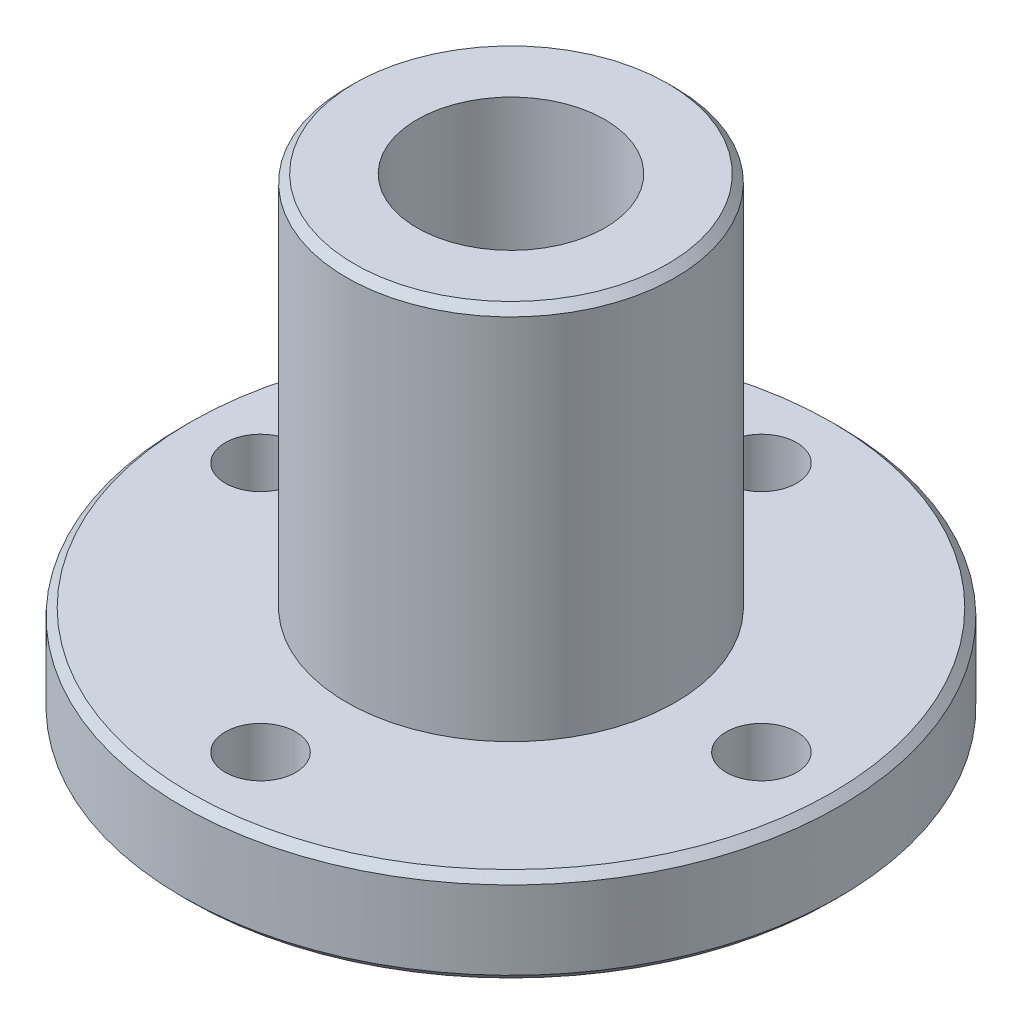
from build123d import *

# Parameters (mm, degrees)
SKETCH2_R             = 6
CUT_EXTRUDE1_DEPTH    = 43.213741838
HOLE_WIZARD_M41_D     = 4.5
HOLE_WIZARD_M41_DEPTH = 22
HOLE_WIZARD_M41_TIP   = 1.351936393
CHAMFER1_SIZE         = 0.5


with BuildPart() as part:
    # Sketch1 → Revolve1 (revolve)
    with BuildSketch(Plane.XY, mode=Mode.PRIVATE) as revolve1_sk:
        Polygon((0, 0), (-21, 0), (-21, 6), (-10.5, 6), (-10.5, 30), (0, 30), align=None)
    revolve(revolve1_sk.sketch.rotate(Axis((0, 0, 0), (0, 1, 0)), 270), axis=Axis((0, 0, 0), (0, 1, 0)))

    # Sketch2 → Cut-Extrude1 (cut, through all)
    with BuildSketch(Plane.XZ):
        with Locations(Location((0, 0, 0), (0, 0, 270))):
            Circle(SKETCH2_R)
    extrude(amount=-CUT_EXTRUDE1_DEPTH, mode=Mode.SUBTRACT)

    # Отверстие с зазором M41
    with Locations(Plane(origin=(0, 6, 0), x_dir=(1, 0, 0), z_dir=(0, 1, 0))):
        with Locations((0, 16), (16, 0), (0, -16), (-16, 0)):
            Hole(HOLE_WIZARD_M41_D / 2, depth=HOLE_WIZARD_M41_DEPTH)
            with Locations((0, 0, -(HOLE_WIZARD_M41_DEPTH + HOLE_WIZARD_M41_TIP / 2))):  # 118° drill point
                Cone(0, HOLE_WIZARD_M41_D / 2, HOLE_WIZARD_M41_TIP, mode=Mode.SUBTRACT)

    # Chamfer1
    chamfer1_edges = [part.edges().sort_by_distance(p)[0] for p in [
        (0, 30, 10.5),
        (0, 6, 21),
        (0, 0, 21),
    ]]
    chamfer(chamfer1_edges, length=CHAMFER1_SIZE)


solid = part.part
